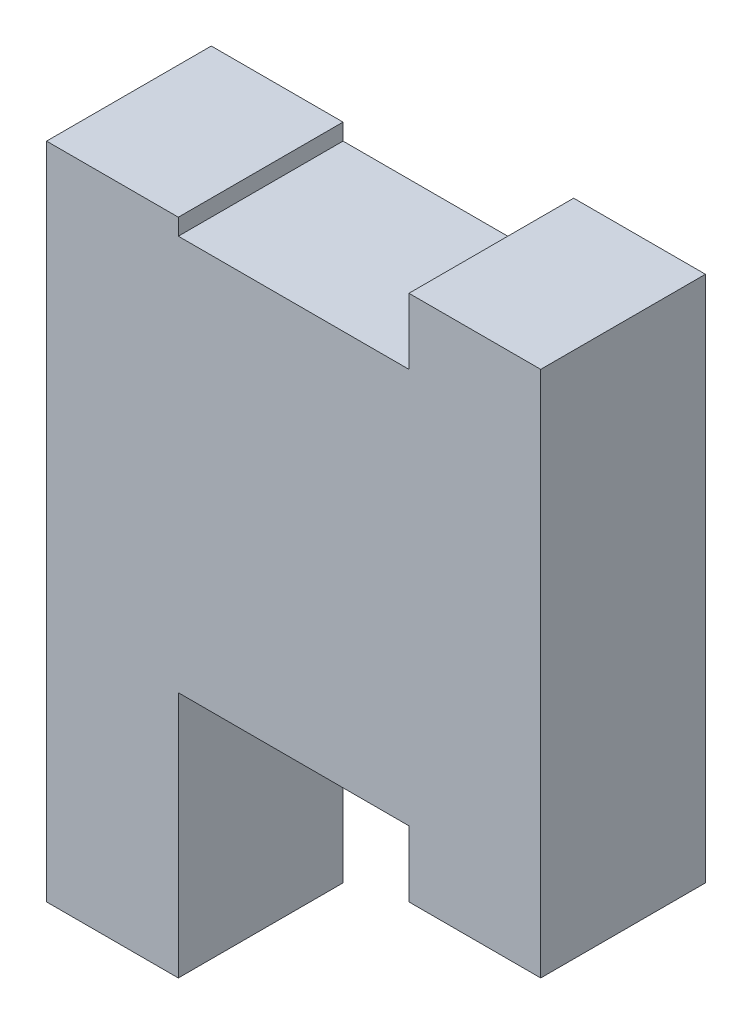
from build123d import *

# Parameters (mm, degrees)
BOSS_EXTRUDE1_DEPTH = 0.125


with BuildPart() as part:
    # frame_outline → Boss-Extrude1 (new, symmetric)
    with BuildSketch(Plane.XY):
        Polygon((0, 0), (0, 1), (0.2, 1), (0.2, 0.975), (0.55, 0.975), (0.55, 1.075), (0.75, 1.075), (0.75, 0.275), (0.55, 0.275), (0.55, 0.375), (0.2, 0.375), (0.2, 0), align=None)
    extrude(amount=BOSS_EXTRUDE1_DEPTH, both=True)


solid = part.part
